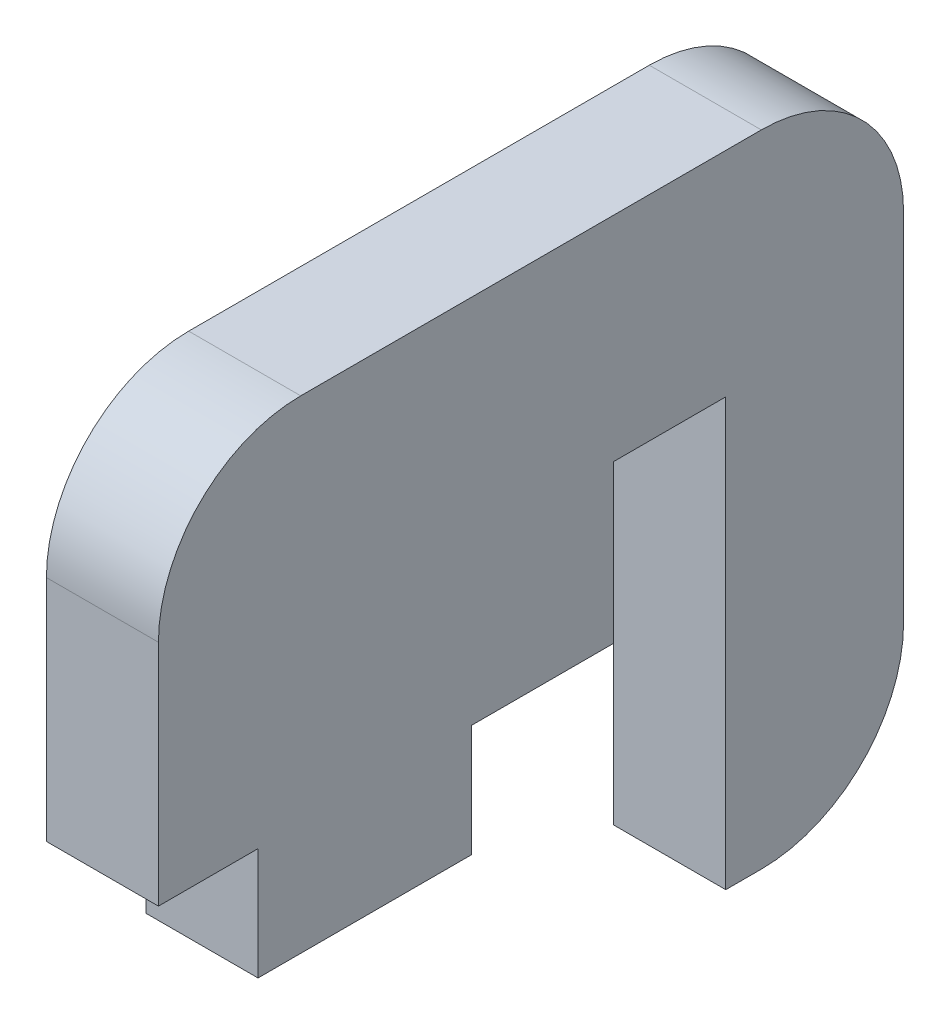
from build123d import *

# Parameters (mm, degrees)
BOSS_EXTRUDE1_DEPTH = 4


with BuildPart() as part:
    # Sketch1 → Boss-Extrude1 (new body)
    with BuildSketch(Plane.YZ):
        with BuildLine():
            Line((0, 0), (4, 0))
            Line((4, 0), (4, 3.556))
            Line((4, 3.556), (12.16, 3.556))
            ThreePointArc((12.16, 3.556), (15.752102448, 2.068102448), (17.24, -1.524))
            Line((17.24, -1.524), (17.24, -17.97))
            ThreePointArc((17.24, -17.97), (15.752102448, -21.562102448), (12.16, -23.05))
            Line((12.16, -23.05), (-0.54, -23.05))
            ThreePointArc((-0.54, -23.05), (-4.132102448, -21.562102448), (-5.62, -17.97))
            Line((-5.62, -17.97), (-5.62, -16.7))
            Line((-5.62, -16.7), (9.62, -16.7))
            Line((9.62, -16.7), (9.62, -12.7))
            Line((9.62, -12.7), (4, -12.7))
            Line((4, -12.7), (4, -7.62))
            Line((4, -7.62), (0, -7.62))
            Line((0, -7.62), (0, 0))
        make_face()
    extrude(amount=BOSS_EXTRUDE1_DEPTH)


solid = part.part
